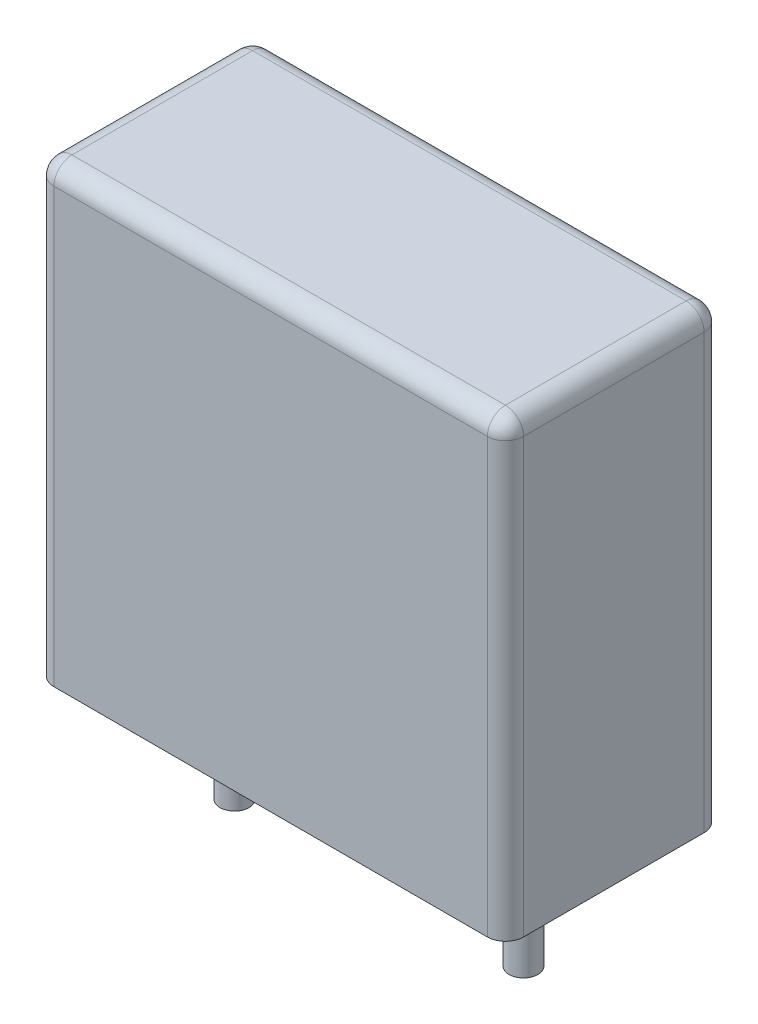
from build123d import *

# Parameters (mm, degrees)
SKETCH_2_W      = 13
SKETCH_2_H      = 6
EXTRUDE_1_DEPTH = 12.5
SKETCH_3_R      = 0.4
EXTRUDE_2_DEPTH = 3.2
FILLET_1_R      = 0.5


with BuildPart() as part:
    # Эскиз2 → Бобышка-Вытянуть1 (new body)
    with BuildSketch(Plane(origin=(0, 0, 0), x_dir=(1, 0, 0), z_dir=(0, 1, 0))):
        Rectangle(SKETCH_2_W, SKETCH_2_H)
    extrude(amount=EXTRUDE_1_DEPTH)

    # Эскиз3 → Бобышка-Вытянуть2 (add)
    with BuildSketch(Plane.XZ):
        with Locations(Location((-4, 0, 0), (0, 0, 270))):
            Circle(SKETCH_3_R)
        with Locations(Location((4, 0, 0), (0, 0, 270))):
            Circle(SKETCH_3_R)
    extrude(amount=EXTRUDE_2_DEPTH)

    # Скругление1
    fillet_1_edges = [part.edges().sort_by_distance(p)[0] for p in [
        (-6.5, 12.5, 0),
        (0, 12.5, 3),
        (6.5, 12.5, 0),
        (6.5, 6.25, 3),
        (-6.5, 6.25, 3),
        (-6.5, 6.25, -3),
        (6.5, 6.25, -3),
        (0, 12.5, -3),
    ]]
    fillet(fillet_1_edges, radius=FILLET_1_R)


solid = part.part
